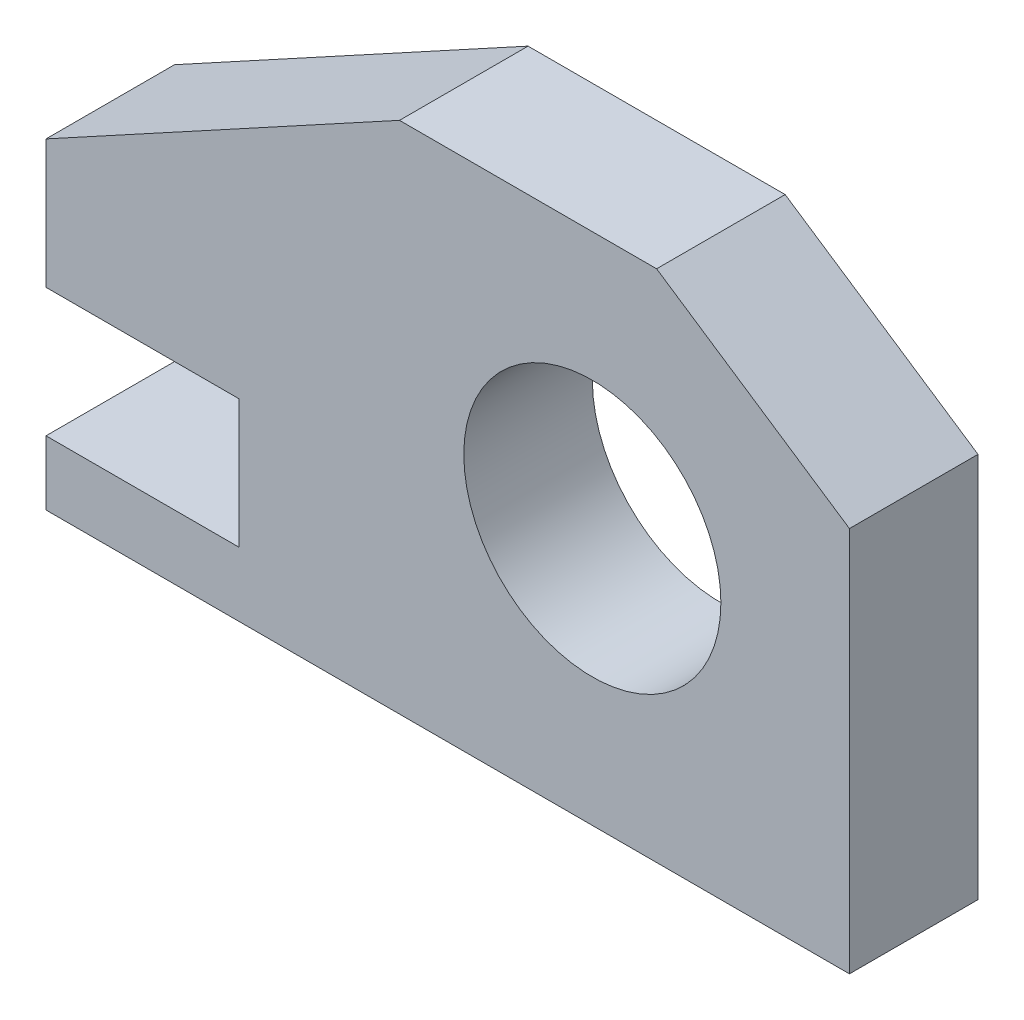
from build123d import *

# Parameters (mm, degrees)
SKETCH1_R           = 12.7
BOSS_EXTRUDE1_DEPTH = 12.7


with BuildPart() as part:
    # Sketch1 → Boss-Extrude1 (new body)
    with BuildSketch(Plane.XY):
        Polygon((79.373528244, 38.1), (60.323528244, 50.8), (34.923528244, 50.8), (0, 31.75), (0, 19.05), (19.05, 19.05), (19.05, 6.35), (0, 6.35), (0, 0), (79.373528244, 0), align=None)
        with Locations((53.973528244, 25.4)):
            Circle(SKETCH1_R, mode=Mode.SUBTRACT)
    extrude(amount=BOSS_EXTRUDE1_DEPTH)


solid = part.part
